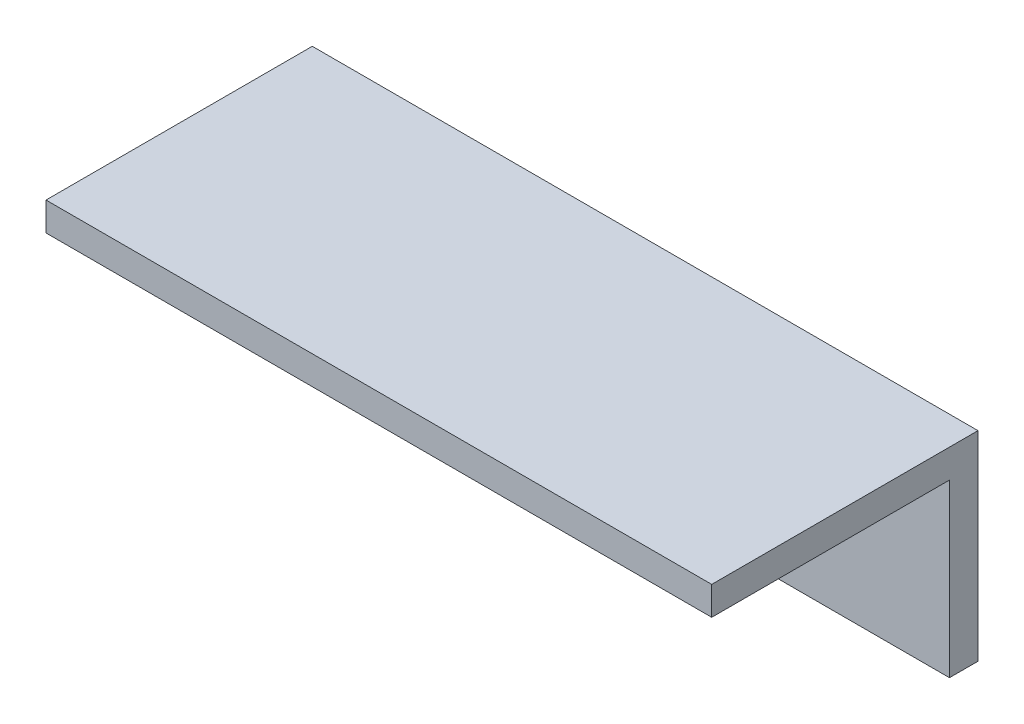
from build123d import *

# Parameters (mm, degrees)
SKETCH1_W           = 350
SKETCH1_H           = 60
BOSS_EXTRUDE1_DEPTH = 15
SKETCH3_W           = 350
SKETCH3_H           = 15
BOSS_EXTRUDE4_DEPTH = 80
SKETCH5_W           = 350
SKETCH5_H           = 15
BOSS_EXTRUDE5_DEPTH = 90


with BuildPart() as part:
    # Sketch1 → Boss-Extrude1 (new body)
    with BuildSketch(Plane(origin=(0, 0, 0), x_dir=(1, 0, 0), z_dir=(0, 1, 0))):
        with Locations((175, -30)):
            Rectangle(SKETCH1_W, SKETCH1_H)
    extrude(amount=BOSS_EXTRUDE1_DEPTH)

    # Sketch3 → Boss-Extrude4 (add)
    with BuildSketch(Plane(origin=(0, 0, 0), x_dir=(-1, 0, 0), z_dir=(0, 0, -1))):
        with Locations((-175, 7.5)):
            Rectangle(SKETCH3_W, SKETCH3_H)
    extrude(amount=BOSS_EXTRUDE4_DEPTH)

    # Sketch5 → Boss-Extrude5 (add)
    with BuildSketch(Plane.XZ):
        with Locations((175, -72.5)):
            Rectangle(SKETCH5_W, SKETCH5_H)
    extrude(amount=BOSS_EXTRUDE5_DEPTH)


solid = part.part
